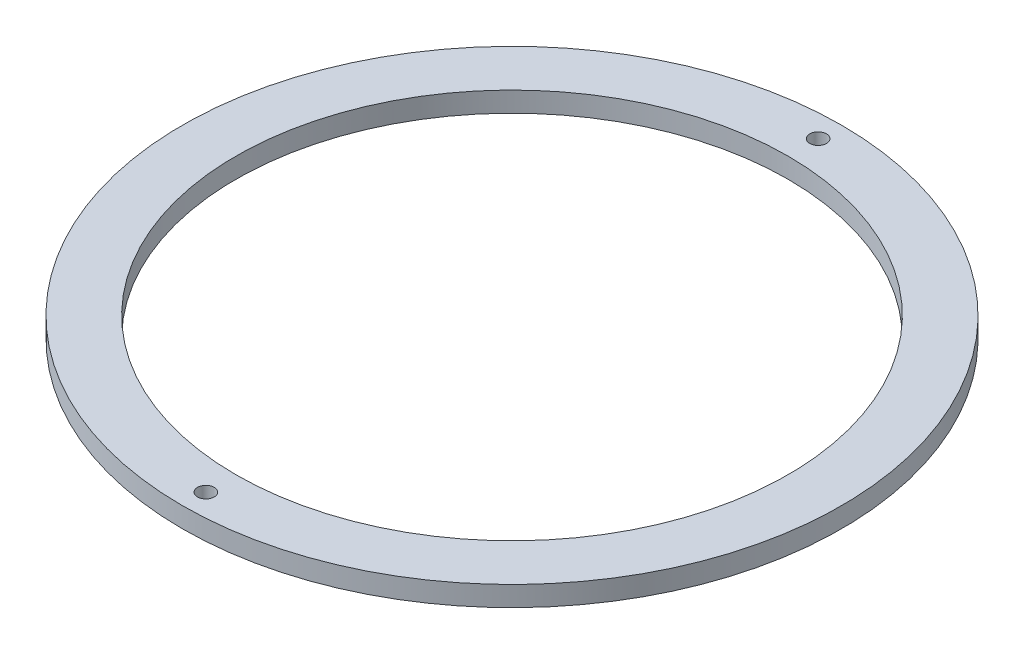
from build123d import *

# Parameters (mm, degrees)
SKETCH1_R           = 49.25
SKETCH1_R_2         = 41.25
BOSS_EXTRUDE1_DEPTH = 3
SKETCH4_R           = 1.25
CUT_EXTRUDE2_DEPTH  = 70.71459675


with BuildPart() as part:
    # Sketch1 → Boss-Extrude1 (new body)
    with BuildSketch(Plane(origin=(0, 0, 0), x_dir=(1, 0, 0), z_dir=(0, 1, 0))):
        with Locations(Location((0, 0, 0), (0, 0, 270))):
            Circle(SKETCH1_R)
        with Locations(Location((0, 0, 0), (0, 0, 270))):
            Circle(SKETCH1_R_2, mode=Mode.SUBTRACT)
    extrude(amount=BOSS_EXTRUDE1_DEPTH)

    # Sketch4 → Cut-Extrude2 (cut, through all)
    with BuildSketch(Plane(origin=(0, 3, 0), x_dir=(1, 0, 0), z_dir=(0, 1, 0))):
        with Locations(Location((0, 45.75, 0), (0, 0, 270))):
            Circle(SKETCH4_R)
        with Locations(Location((0, -45.75, 0), (0, 0, 270))):
            Circle(SKETCH4_R)
    extrude(amount=-CUT_EXTRUDE2_DEPTH, mode=Mode.SUBTRACT)


solid = part.part
